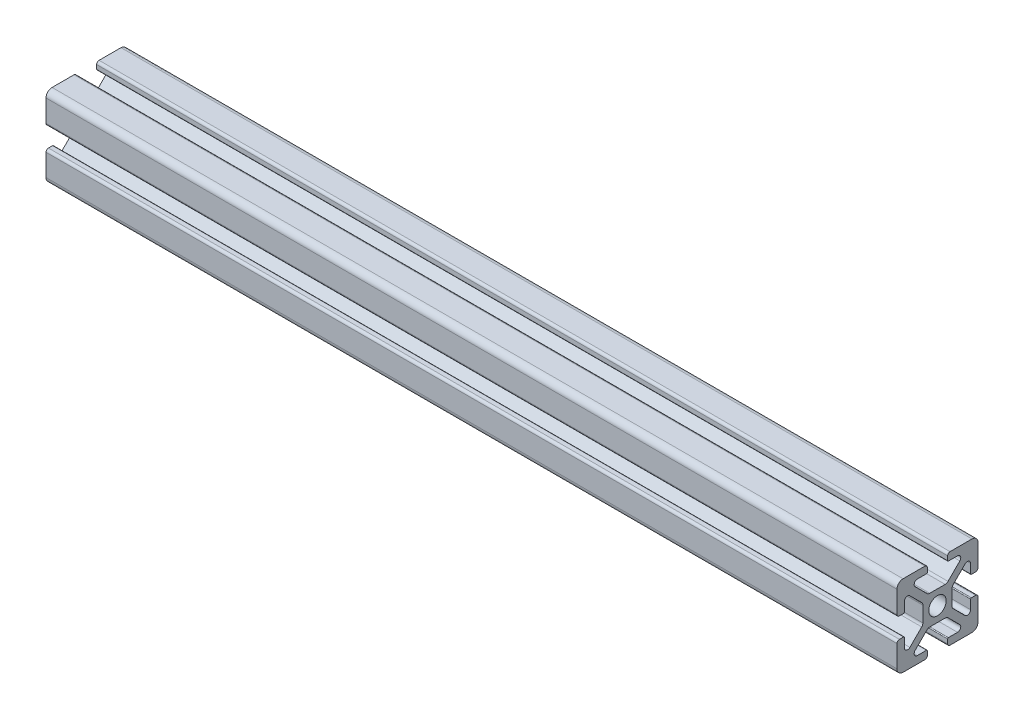
from build123d import *

# Parameters (mm, degrees)
BOSS_EXTRUDE1_DEPTH      = 152.4
BOSS_EXTRUDE1_DEPTH_BACK = 152.4
CUT_EXTRUDE1_START       = -94.8
SKETCH4_R                = 2.15
CUT_EXTRUDE1_DEPTH       = 94.8


with BuildPart() as part:
    # Sketch3 → Boss-Extrude1 (new, two sides: drawn at the far end of the back side and taken through both)
    with BuildSketch(Plane(origin=(0, 0, 0), x_dir=(0, 0, -1), z_dir=(1, 0, 0)).offset(-BOSS_EXTRUDE1_DEPTH_BACK)):
        with BuildLine():
            Line((-5.515685425, 6.807463915), (-2.601114729, 3.892893219))
            ThreePointArc((-2.601114729, 3.892893219), (-2.27669138, 3.676120467), (-1.894007948, 3.6))
            Line((-1.894007948, 3.6), (0, 3.6))
            Line((0, 3.6), (0, 2.15))
            ThreePointArc((0, 2.15), (-1.52027958, 1.52027958), (-2.15, 0))
            Line((-2.15, 0), (-3.6, 0))
            Line((-3.6, 0), (-3.6, 1.894007948))
            ThreePointArc((-3.6, 1.894007948), (-3.676120467, 2.27669138), (-3.892893219, 2.601114729))
            Line((-3.892893219, 2.601114729), (-6.807463915, 5.515685425))
            ThreePointArc((-6.807463915, 5.515685425), (-7.679296086, 5.689103626), (-8.17314934, 4.95))
            Line((-8.17314934, 4.95), (-8.17314934, 2.7))
            ThreePointArc((-8.17314934, 2.7), (-8.231727984, 2.558578644), (-8.37314934, 2.5))
            Line((-8.37314934, 2.5), (-9.4, 2.5))
            ThreePointArc((-9.4, 2.5), (-9.824264069, 2.675735931), (-10, 3.1))
            Line((-10, 3.1), (-10, 8.5))
            ThreePointArc((-10, 8.5), (-9.560660172, 9.560660172), (-8.5, 10))
            Line((-8.5, 10), (-3.1, 10))
            ThreePointArc((-3.1, 10), (-2.675735931, 9.824264069), (-2.5, 9.4))
            Line((-2.5, 9.4), (-2.5, 8.37314934))
            ThreePointArc((-2.5, 8.37314934), (-2.558578644, 8.231727984), (-2.7, 8.17314934))
            Line((-2.7, 8.17314934), (-4.95, 8.17314934))
            ThreePointArc((-4.95, 8.17314934), (-5.689103626, 7.679296086), (-5.515685425, 6.807463915))
        make_face()
    extrude(amount=BOSS_EXTRUDE1_DEPTH + BOSS_EXTRUDE1_DEPTH_BACK)

    # Mirror1: part across plane


with BuildPart() as part_1:
    add(part.part)
    add(part.part.mirror(Plane.ZX))

    # Mirror2: part across plane


with BuildPart() as part_2:
    add(part_1.part)
    add(part_1.part.mirror(Plane.XY))

    # Sketch4 → Cut-Extrude1 (cut)
    with BuildSketch(Plane(origin=(152.4, 0, 0), x_dir=(0, 0, -1), z_dir=(1, 0, 0)).offset(CUT_EXTRUDE1_START)):
        with BuildLine():
            Line((1.894007948, 3.6), (-1.894007948, 3.6))
            ThreePointArc((-1.894007948, 3.6), (-2.27669138, 3.676120467), (-2.601114729, 3.892893219))
            Line((-2.601114729, 3.892893219), (-5.515685425, 6.807463915))
            ThreePointArc((-5.515685425, 6.807463915), (-5.689103626, 7.679296086), (-4.95, 8.17314934))
            Line((-4.95, 8.17314934), (-2.7, 8.17314934))
            ThreePointArc((-2.7, 8.17314934), (-2.558578644, 8.231727984), (-2.5, 8.37314934))
            Line((-2.5, 8.37314934), (-2.5, 9.4))
            ThreePointArc((-2.5, 9.4), (-2.675735931, 9.824264069), (-3.1, 10))
            Line((-3.1, 10), (-8.5, 10))
            ThreePointArc((-8.5, 10), (-9.560660172, 9.560660172), (-10, 8.5))
            Line((-10, 8.5), (-10, 3.1))
            ThreePointArc((-10, 3.1), (-9.824264069, 2.675735931), (-9.4, 2.5))
            Line((-9.4, 2.5), (-8.37314934, 2.5))
            ThreePointArc((-8.37314934, 2.5), (-8.231727984, 2.558578644), (-8.17314934, 2.7))
            Line((-8.17314934, 2.7), (-8.17314934, 4.95))
            ThreePointArc((-8.17314934, 4.95), (-7.679296086, 5.689103626), (-6.807463915, 5.515685425))
            Line((-6.807463915, 5.515685425), (-3.892893219, 2.601114729))
            ThreePointArc((-3.892893219, 2.601114729), (-3.676120467, 2.27669138), (-3.6, 1.894007948))
            Line((-3.6, 1.894007948), (-3.6, -1.894007948))
            ThreePointArc((-3.6, -1.894007948), (-3.676120467, -2.27669138), (-3.892893219, -2.601114729))
            Line((-3.892893219, -2.601114729), (-6.807463915, -5.515685425))
            ThreePointArc((-6.807463915, -5.515685425), (-7.679296086, -5.689103626), (-8.17314934, -4.95))
            Line((-8.17314934, -4.95), (-8.17314934, -2.7))
            ThreePointArc((-8.17314934, -2.7), (-8.231727984, -2.558578644), (-8.37314934, -2.5))
            Line((-8.37314934, -2.5), (-9.4, -2.5))
            ThreePointArc((-9.4, -2.5), (-9.824264069, -2.675735931), (-10, -3.1))
            Line((-10, -3.1), (-10, -8.5))
            ThreePointArc((-10, -8.5), (-9.560660172, -9.560660172), (-8.5, -10))
            Line((-8.5, -10), (-3.1, -10))
            ThreePointArc((-3.1, -10), (-2.675735931, -9.824264069), (-2.5, -9.4))
            Line((-2.5, -9.4), (-2.5, -8.37314934))
            ThreePointArc((-2.5, -8.37314934), (-2.558578644, -8.231727984), (-2.7, -8.17314934))
            Line((-2.7, -8.17314934), (-4.95, -8.17314934))
            ThreePointArc((-4.95, -8.17314934), (-5.689103626, -7.679296086), (-5.515685425, -6.807463915))
            Line((-5.515685425, -6.807463915), (-2.601114729, -3.892893219))
            ThreePointArc((-2.601114729, -3.892893219), (-2.27669138, -3.676120467), (-1.894007948, -3.6))
            Line((-1.894007948, -3.6), (1.894007948, -3.6))
            ThreePointArc((1.894007948, -3.6), (2.27669138, -3.676120467), (2.601114729, -3.892893219))
            Line((2.601114729, -3.892893219), (5.515685425, -6.807463915))
            ThreePointArc((5.515685425, -6.807463915), (5.689103626, -7.679296086), (4.95, -8.17314934))
            Line((4.95, -8.17314934), (2.7, -8.17314934))
            ThreePointArc((2.7, -8.17314934), (2.558578644, -8.231727984), (2.5, -8.37314934))
            Line((2.5, -8.37314934), (2.5, -9.4))
            ThreePointArc((2.5, -9.4), (2.675735931, -9.824264069), (3.1, -10))
            Line((3.1, -10), (8.5, -10))
            ThreePointArc((8.5, -10), (9.560660172, -9.560660172), (10, -8.5))
            Line((10, -8.5), (10, -3.1))
            ThreePointArc((10, -3.1), (9.824264069, -2.675735931), (9.4, -2.5))
            Line((9.4, -2.5), (8.37314934, -2.5))
            ThreePointArc((8.37314934, -2.5), (8.231727984, -2.558578644), (8.17314934, -2.7))
            Line((8.17314934, -2.7), (8.17314934, -4.95))
            ThreePointArc((8.17314934, -4.95), (7.679296086, -5.689103626), (6.807463915, -5.515685425))
            Line((6.807463915, -5.515685425), (3.892893219, -2.601114729))
            ThreePointArc((3.892893219, -2.601114729), (3.676120467, -2.27669138), (3.6, -1.894007948))
            Line((3.6, -1.894007948), (3.6, 1.894007948))
            ThreePointArc((3.6, 1.894007948), (3.676120467, 2.27669138), (3.892893219, 2.601114729))
            Line((3.892893219, 2.601114729), (6.807463915, 5.515685425))
            ThreePointArc((6.807463915, 5.515685425), (7.679296086, 5.689103626), (8.17314934, 4.95))
            Line((8.17314934, 4.95), (8.17314934, 2.7))
            ThreePointArc((8.17314934, 2.7), (8.231727984, 2.558578644), (8.37314934, 2.5))
            Line((8.37314934, 2.5), (9.4, 2.5))
            ThreePointArc((9.4, 2.5), (9.824264069, 2.675735931), (10, 3.1))
            Line((10, 3.1), (10, 8.5))
            ThreePointArc((10, 8.5), (9.560660172, 9.560660172), (8.5, 10))
            Line((8.5, 10), (3.1, 10))
            ThreePointArc((3.1, 10), (2.675735931, 9.824264069), (2.5, 9.4))
            Line((2.5, 9.4), (2.5, 8.37314934))
            ThreePointArc((2.5, 8.37314934), (2.558578644, 8.231727984), (2.7, 8.17314934))
            Line((2.7, 8.17314934), (4.95, 8.17314934))
            ThreePointArc((4.95, 8.17314934), (5.689103626, 7.679296086), (5.515685425, 6.807463915))
            Line((5.515685425, 6.807463915), (2.601114729, 3.892893219))
            ThreePointArc((2.601114729, 3.892893219), (2.27669138, 3.676120467), (1.894007948, 3.6))
        make_face()
        Circle(SKETCH4_R, mode=Mode.SUBTRACT)
    extrude(amount=CUT_EXTRUDE1_DEPTH, mode=Mode.SUBTRACT)


solid = part_2.part
